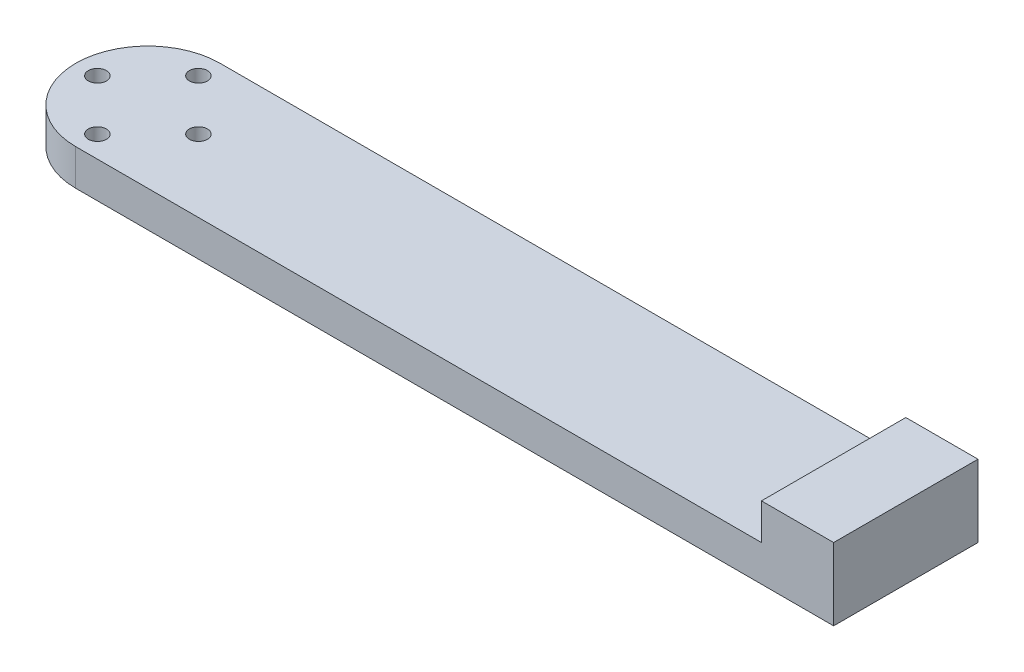
from build123d import *

# Parameters (mm, degrees)
SKETCH1_R           = 10
SKETCH1_R_2         = 1.25
BOSS_EXTRUDE1_DEPTH = 5
BOSS_EXTRUDE2_DEPTH = 5
SKETCH3_W           = 10
SKETCH3_H           = 10
BOSS_EXTRUDE3_DEPTH = 20
SKETCH4_R           = 3
CUT_EXTRUDE1_DEPTH  = 6
CHAMFER1_SIZE       = 3
SKETCH5_W           = 6
SKETCH5_H           = 5
CUT_EXTRUDE2_DEPTH  = 3


with BuildPart() as part:
    # Sketch1 → Boss-Extrude1 (new body)
    with BuildSketch(Plane(origin=(0, 0, 0), x_dir=(1, 0, 0), z_dir=(0, 1, 0))):
        with Locations(Location((0, 0, 0), (0, 0, 270))):
            Circle(SKETCH1_R)
        with Locations(Location((0, 7, 0), (0, 0, 270))):
            Circle(SKETCH1_R_2, mode=Mode.SUBTRACT)
        with Locations(Location((7, 0, 0), (0, 0, 270))):
            Circle(SKETCH1_R_2, mode=Mode.SUBTRACT)
        with Locations(Location((0, -7, 0), (0, 0, 270))):
            Circle(SKETCH1_R_2, mode=Mode.SUBTRACT)
        with Locations(Location((-7, 0, 0), (0, 0, 270))):
            Circle(SKETCH1_R_2, mode=Mode.SUBTRACT)
    extrude(amount=BOSS_EXTRUDE1_DEPTH)

    # Sketch2 → Boss-Extrude2 (add)
    with BuildSketch(Plane(origin=(0, 0, 0), x_dir=(1, 0, 0), z_dir=(0, 1, 0))):
        with BuildLine():
            Line((0, 10), (105, 10))
            Line((105, 10), (105, -10))
            Line((105, -10), (0, -10))
            ThreePointArc((0, -10), (10, 0), (0, 10))
        make_face()
    extrude(amount=BOSS_EXTRUDE2_DEPTH)

    # Sketch3 → Boss-Extrude3 (add)
    with BuildSketch(Plane(origin=(0, 0, -10), x_dir=(-1, 0, 0), z_dir=(0, 0, -1))):
        with Locations((-100, 5)):
            Rectangle(SKETCH3_W, SKETCH3_H)
    extrude(amount=-BOSS_EXTRUDE3_DEPTH)

    # Sketch4 → Cut-Extrude1 (cut)
    with BuildSketch(Plane(origin=(0, 0, -10), x_dir=(-1, 0, 0), z_dir=(0, 0, -1))):
        with Locations((-100, 5)):
            Circle(SKETCH4_R)
    extrude(amount=-CUT_EXTRUDE1_DEPTH, mode=Mode.SUBTRACT)

    # Chamfer1
    chamfer1_edges = [part.edges().sort_by_distance(p)[0] for p in [
        (103, 5, -4),
    ]]
    chamfer(chamfer1_edges, length=CHAMFER1_SIZE)

    # Sketch5 → Cut-Extrude2 (cut)
    with BuildSketch(Plane(origin=(0, 0, -10), x_dir=(-1, 0, 0), z_dir=(0, 0, -1))):
        with Locations((-100, 2.5)):
            Rectangle(SKETCH5_W, SKETCH5_H)
    extrude(amount=-CUT_EXTRUDE2_DEPTH, mode=Mode.SUBTRACT)


solid = part.part
